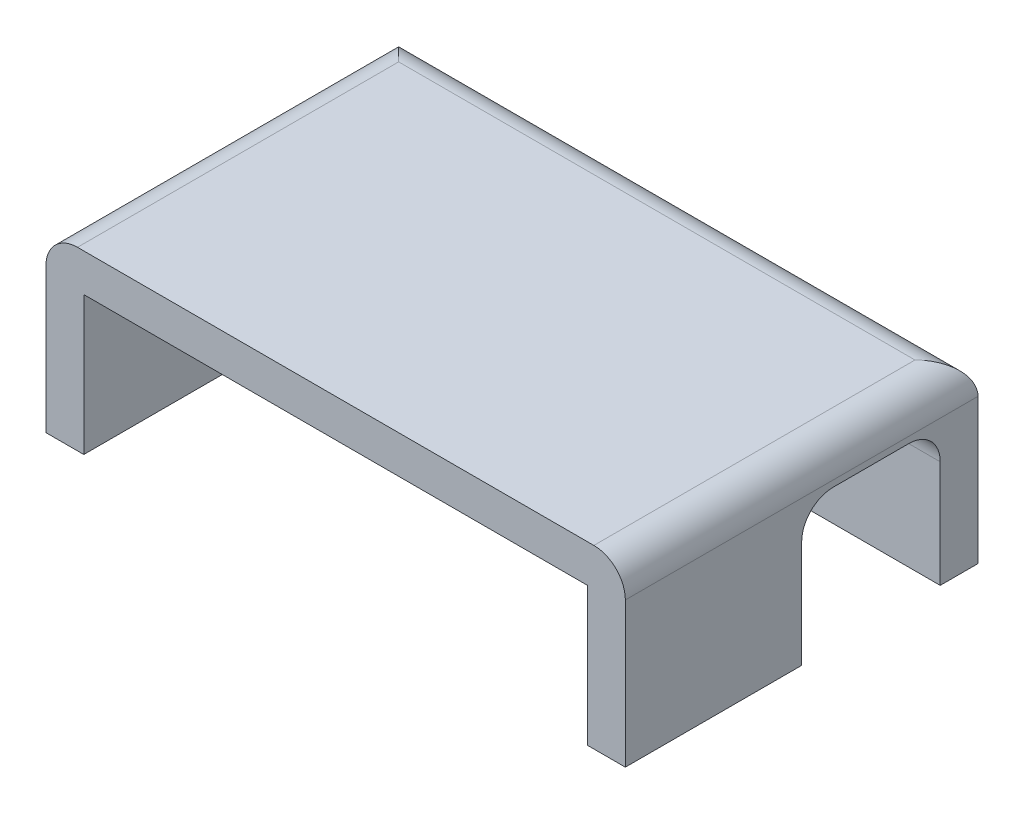
from build123d import *

# Parameters (mm, degrees)
SALIENTE_EXTRUIR1_DEPTH = 14
CROQUIS2_W              = 40
CROQUIS2_H              = 3
SALIENTE_EXTRUIR2_DEPTH = 25
CROQUIS3_W              = 11
CROQUIS3_H              = 11
CORTAR_EXTRUIR1_DEPTH   = 12
REDONDEO1_R             = 2.5


with BuildPart() as part:
    # Croquis1 → Saliente-Extruir1 (new body)
    with BuildSketch(Plane(origin=(0, 0, 0), x_dir=(1, 0, 0), z_dir=(0, 1, 0))):
        Polygon((-40, 0), (-40, 25), (0, 25), (0, 0), (3, 0), (3, 28), (-43, 28), (-43, 0), align=None)
    extrude(amount=SALIENTE_EXTRUIR1_DEPTH)

    # Croquis2 → Saliente-Extruir2 (add)
    with BuildSketch(Plane.XY.offset(-25)):
        with Locations((-20, 12.5)):
            Rectangle(CROQUIS2_W, CROQUIS2_H)
    extrude(amount=SALIENTE_EXTRUIR2_DEPTH)

    # Croquis3 → Cortar-Extruir1 (cut)
    with BuildSketch(Plane(origin=(3, 0, 0), x_dir=(0, 0, -1), z_dir=(1, 0, 0))):
        with Locations((19.5, 5.5)):
            Rectangle(CROQUIS3_W, CROQUIS3_H)
    extrude(amount=-CORTAR_EXTRUIR1_DEPTH, mode=Mode.SUBTRACT)

    # Redondeo1
    redondeo1_edges = [part.edges().sort_by_distance(p)[0] for p in [
        (-18.5, 11, -25),
        (3, 14, -14),
        (-20, 14, -28),
        (1.5, 11, -14),
        (-43, 14, -14),
    ]]
    fillet(redondeo1_edges, radius=REDONDEO1_R)


solid = part.part
